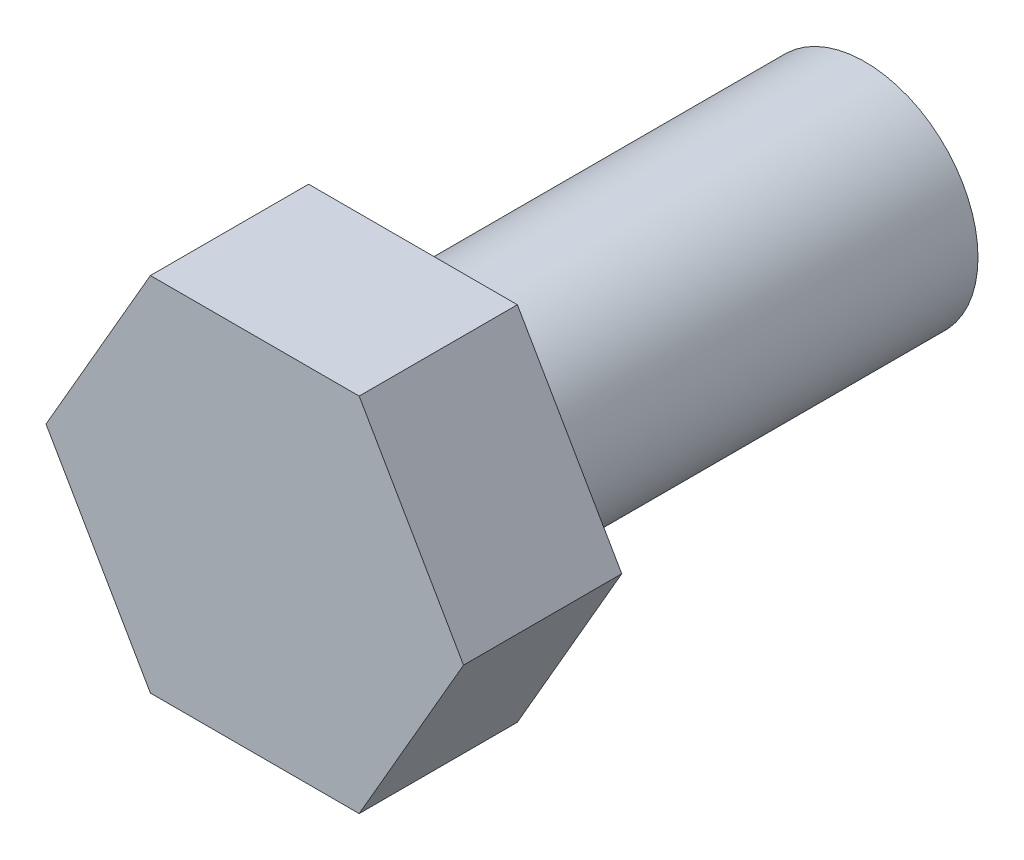
from build123d import *

# Parameters (mm, degrees)
SKETCH1_R      = 2.5
EXTRUDE1_DEPTH = 10
EXTRUDE2_DEPTH = 3.5


with BuildPart() as part:
    # Sketch1 → Extrude1 (new body)
    with BuildSketch(Plane.XY):
        Circle(SKETCH1_R)
    extrude(amount=-EXTRUDE1_DEPTH)

    # Sketch2 → Extrude2 (add)
    with BuildSketch(Plane.XY):
        Polygon((-2.309401077, 4), (-4.618802154, 0), (-2.309401077, -4), (2.309401077, -4), (4.618802154, 0), (2.309401077, 4), align=None)
    extrude(amount=EXTRUDE2_DEPTH)


solid = part.part
